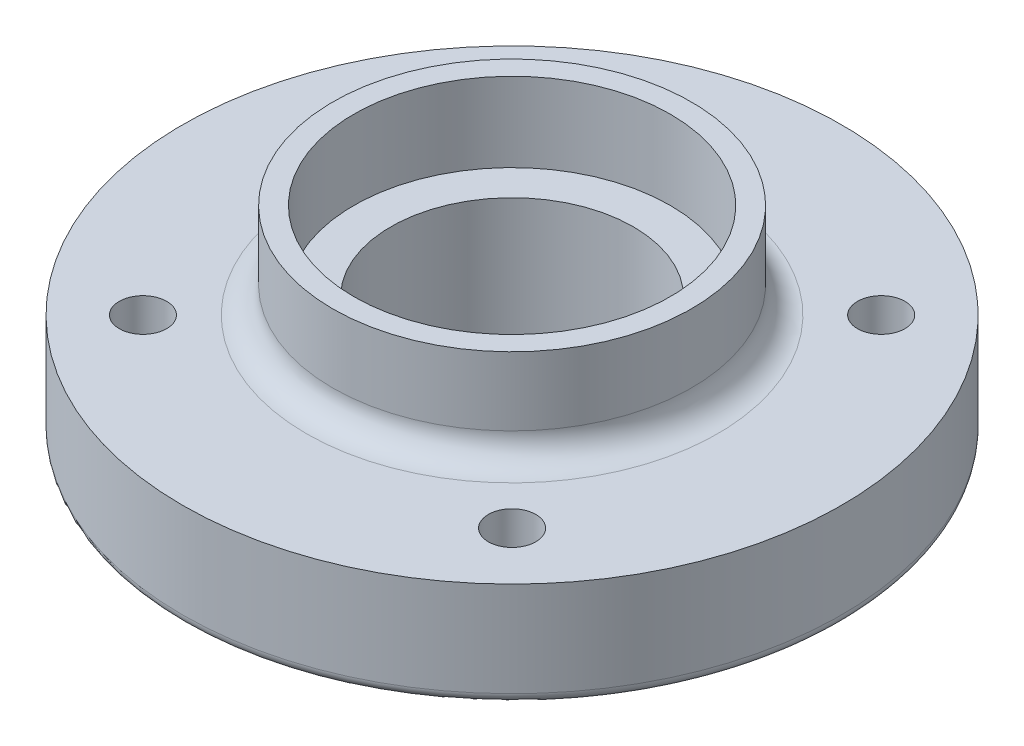
from build123d import *

# Parameters (mm, degrees)
SKETCH1_R                               = 62.5
BOSS_EXTRUDE1_DEPTH                     = 20
SKETCH2_R                               = 34
BOSS_EXTRUDE2_DEPTH                     = 18
SKETCH6_R                               = 30
CUT_EXTRUDE1_DEPTH                      = 15
FILLET1_R                               = 5
CBORE_FOR_M8_HEX_HEAD_BOLT1_D           = 9
CBORE_FOR_M8_HEX_HEAD_BOLT1_CBORE_D     = 18.011
CBORE_FOR_M8_HEX_HEAD_BOLT1_CBORE_DEPTH = 5.3
FILLET2_R                               = 2
SKETCH10_R                              = 23
CUT_EXTRUDE2_DEPTH                      = 53
SKETCH11_R                              = 35
SKETCH11_R_2                            = 23
BOSS_EXTRUDE3_DEPTH                     = 15
FILLET3_R                               = 1


with BuildPart() as part:
    # Sketch1 → Boss-Extrude1 (new body)
    with BuildSketch(Plane(origin=(0, 0, 0), x_dir=(1, 0, 0), z_dir=(0, 1, 0))):
        with Locations(Location((0, 0, 0), (0, 0, 270))):
            Circle(SKETCH1_R)
    extrude(amount=BOSS_EXTRUDE1_DEPTH)

    # Sketch2 → Boss-Extrude2 (add)
    with BuildSketch(Plane(origin=(0, 20, 0), x_dir=(1, 0, 0), z_dir=(0, 1, 0))):
        with Locations(Location((0, 0, 0), (0, 0, 270))):
            Circle(SKETCH2_R)
    extrude(amount=BOSS_EXTRUDE2_DEPTH)

    # Sketch6 → Cut-Extrude1 (cut)
    with BuildSketch(Plane(origin=(0, 38, 0), x_dir=(1, 0, 0), z_dir=(0, 1, 0))):
        with Locations(Location((0, 0, 0), (0, 0, 270))):
            Circle(SKETCH6_R)
    extrude(amount=-CUT_EXTRUDE1_DEPTH, mode=Mode.SUBTRACT)

    # Fillet1
    fillet1_edges = [part.edges().sort_by_distance(p)[0] for p in [
        (0, 20, -34),
    ]]
    fillet(fillet1_edges, radius=FILLET1_R)

    # CBORE for M8 Hex Head Bolt1 (through all)
    with Locations(Plane(origin=(-35, 0, 35), x_dir=(0, 0, -1), z_dir=(0, -1, 0))):
        with Locations((0, 0), (0, 70), (70, 70), (70, 0)):
            CounterBoreHole(CBORE_FOR_M8_HEX_HEAD_BOLT1_D / 2, CBORE_FOR_M8_HEX_HEAD_BOLT1_CBORE_D / 2, CBORE_FOR_M8_HEX_HEAD_BOLT1_CBORE_DEPTH)

    # Fillet2
    fillet2_edges = [part.edges().sort_by_distance(p)[0] for p in [
        (0, 0, -62.5),
    ]]
    fillet(fillet2_edges, radius=FILLET2_R)

    # Sketch10 → Cut-Extrude2 (cut)
    with BuildSketch(Plane(origin=(0, 23, 0), x_dir=(1, 0, 0), z_dir=(0, 1, 0))):
        with Locations(Location((0, 0, 0), (0, 0, 270))):
            Circle(SKETCH10_R)
    extrude(amount=-CUT_EXTRUDE2_DEPTH, mode=Mode.SUBTRACT)

    # Sketch11 → Boss-Extrude3 (add)
    with BuildSketch(Plane.XZ):
        with Locations(Location((0, 0, 0), (0, 0, 90))):
            Circle(SKETCH11_R)
        with Locations(Location((0, 0, 0), (0, 0, 90))):
            Circle(SKETCH11_R_2, mode=Mode.SUBTRACT)
    extrude(amount=BOSS_EXTRUDE3_DEPTH)

    # Fillet3
    fillet3_edges = [part.edges().sort_by_distance(p)[0] for p in [
        (0, 0, -35),
        (0, -15, -35),
    ]]
    fillet(fillet3_edges, radius=FILLET3_R)


solid = part.part
